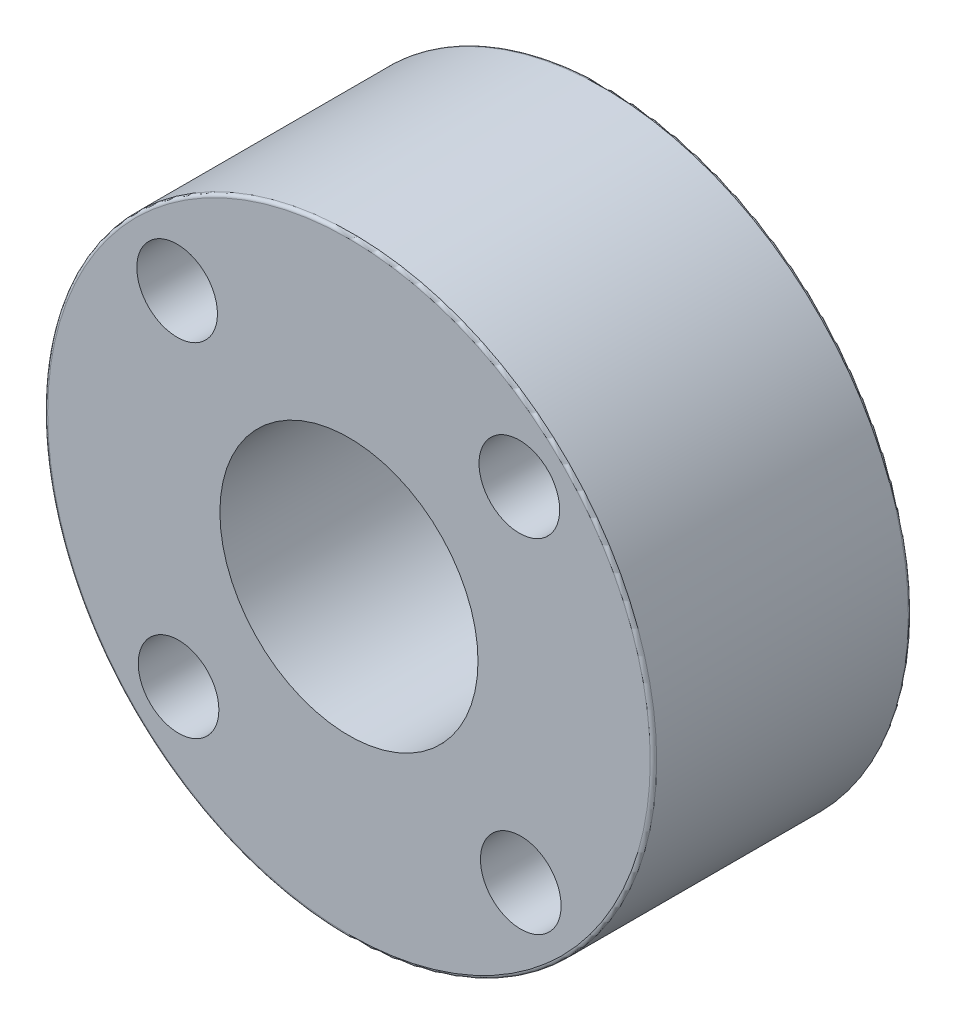
from build123d import *

# Parameters (mm, degrees)
SKETCH_1_R      = 9.43812854
SKETCH_1_R_2    = 4
SKETCH_1_R_3    = 1.25
EXTRUDE_1_DEPTH = 8
FILLET_1_R      = 0.1


with BuildPart() as part:
    # Эскиз1 → Бобышка-Вытянуть1 (new body)
    with BuildSketch(Plane.XY):
        Circle(SKETCH_1_R)
        Circle(SKETCH_1_R_2, mode=Mode.SUBTRACT)
        with Locations((-5.325171984, 5.281339162)):
            Circle(SKETCH_1_R_3, mode=Mode.SUBTRACT)
        with Locations((-5.281339162, -5.325171984)):
            Circle(SKETCH_1_R_3, mode=Mode.SUBTRACT)
        with Locations((5.325171984, -5.281339162)):
            Circle(SKETCH_1_R_3, mode=Mode.SUBTRACT)
        with Locations((5.281339162, 5.325171984)):
            Circle(SKETCH_1_R_3, mode=Mode.SUBTRACT)
    extrude(amount=EXTRUDE_1_DEPTH)

    # Скругление1
    fillet_1_edges = [part.edges().sort_by_distance(p)[0] for p in [
        (-9.43812854, 0, 0),
        (-9.43812854, 0, 8),
    ]]
    fillet(fillet_1_edges, radius=FILLET_1_R)


solid = part.part
